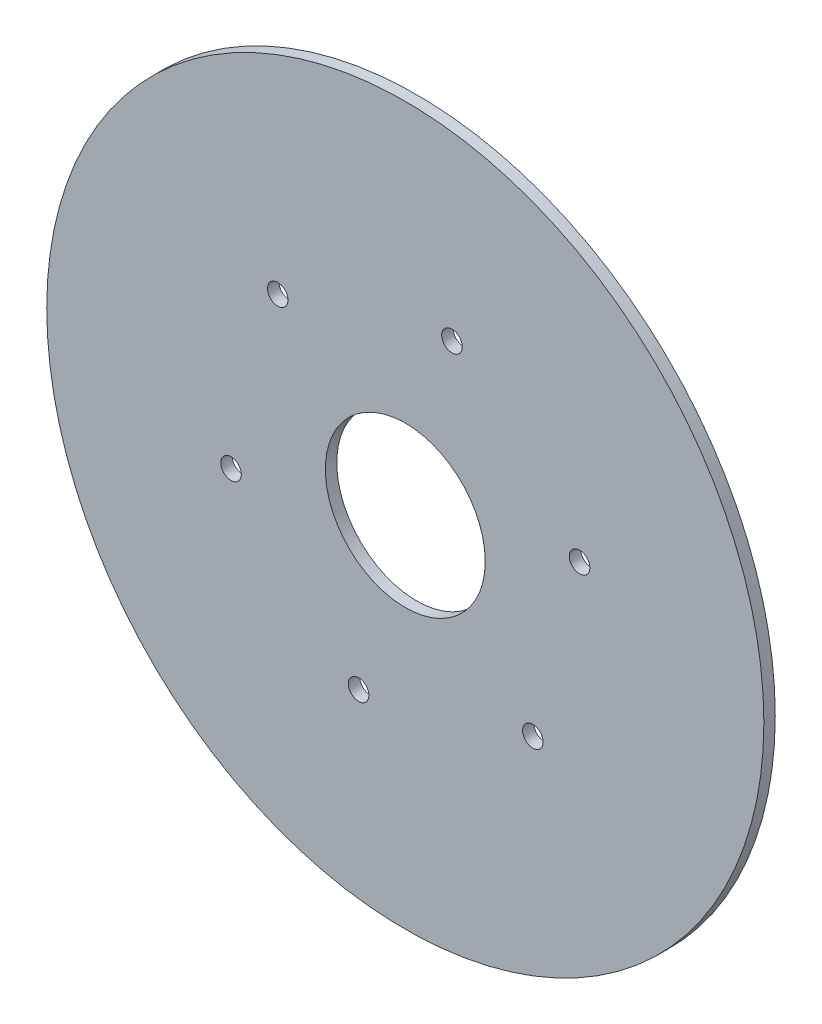
from build123d import *

# Parameters (mm, degrees)
FRONT_COVER_REFERENCE_START = 58.5
SKETCH_1_R                  = 78.5
SKETCH_1_R_2                = 17.5
FRONT_COVER_REFERENCE_DEPTH = 2.5
SKETCH_2_R                  = 2.25
THROUGH_HOLES_DEPTH         = 100


with BuildPart() as part:
    # Эскиз1 → Front_cover_reference (new body)
    with BuildSketch(Plane.XY.offset(FRONT_COVER_REFERENCE_START)):
        Circle(SKETCH_1_R)
        Circle(SKETCH_1_R_2, mode=Mode.SUBTRACT)
    extrude(amount=FRONT_COVER_REFERENCE_DEPTH)

    # Эскиз2 → Through_holes (cut, symmetric)
    with BuildSketch(Plane.XY):
        with Locations((38.154070138, 10.223352282)):
            Circle(SKETCH_2_R)
        with Locations((10.223352282, 38.154070138)):
            Circle(SKETCH_2_R)
        with Locations((-27.930717857, 27.930717857)):
            Circle(SKETCH_2_R)
        with Locations((-38.154070138, -10.223352282)):
            Circle(SKETCH_2_R)
        with Locations((-10.223352282, -38.154070138)):
            Circle(SKETCH_2_R)
        with Locations((27.930717857, -27.930717857)):
            Circle(SKETCH_2_R)
    extrude(amount=THROUGH_HOLES_DEPTH, both=True, mode=Mode.SUBTRACT)


solid = part.part
